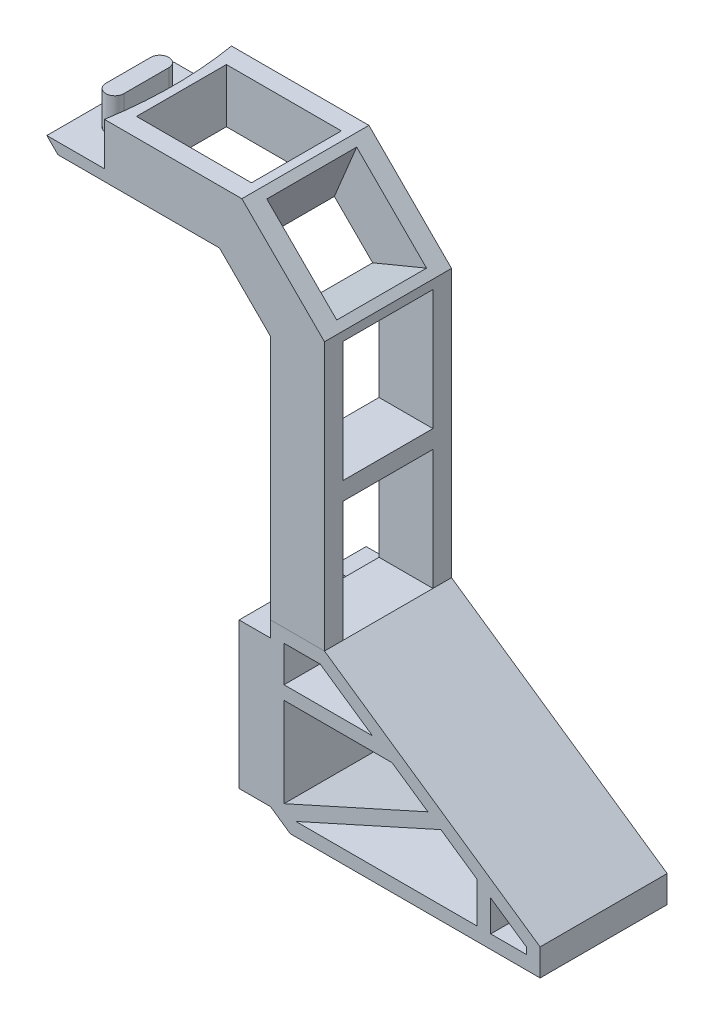
from build123d import *

# Parameters (mm, degrees)
BOSS_EXTRUDE1_DEPTH = 14.14
CUT_EXTRUDE1_REACH  = 40.3
BOSS_EXTRUDE2_DEPTH = 14.14
BOSS_EXTRUDE8_REACH = 69.576
BOSS_EXTRUDE5_DEPTH = 3.75
SKETCH10_W          = 14.14
SKETCH10_H          = 1.75
BOSS_EXTRUDE6_DEPTH = 3.5
BOSS_EXTRUDE7_DEPTH = 14.5
SKETCH15_W          = 6
SKETCH15_H          = 13.403805922
CUT_EXTRUDE7_DEPTH  = 5


with BuildPart() as part:
    # Sketch1 → Boss-Extrude1 (new body)
    with BuildSketch(Plane.XY):
        Polygon((0.707106781, 0), (0.707106781, 18), (6.707106781, 18), (30.707106781, 1.488209222), (30.707106781, -1.511790778), (2.904504941, -1.511790778), align=None)
    extrude(amount=BOSS_EXTRUDE1_DEPTH)

    # Sketch2 → Cut-Extrude1 (cut, up to next)
    with BuildSketch(Plane.XY.offset(14.14), mode=Mode.PRIVATE) as cut_extrude1_sk1:
        Polygon((2.207106781, 16.5), (2.207106781, 12.5), (12.054974944, 12.5), (6.240947786, 16.5), align=None)
    cut_extrude1_tool1 = extrude(cut_extrude1_sk1.sketch, amount=-CUT_EXTRUDE1_REACH, mode=Mode.PRIVATE) & part.part
    # Sketch2 → Cut-Extrude1 (cut, up to next)
    with BuildSketch(Plane.XY.offset(14.14), mode=Mode.PRIVATE) as cut_extrude1_sk2:
        Polygon((14.235235128, 11), (2.207106781, 11), (2.207106781, 1.039488327), (18.219044647, 8.25917378), align=None)
    cut_extrude1_tool2 = extrude(cut_extrude1_sk2.sketch, amount=-CUT_EXTRUDE1_REACH, mode=Mode.PRIVATE) & part.part
    # Sketch2 → Cut-Extrude1 (cut, up to next)
    with BuildSketch(Plane.XY.offset(14.14), mode=Mode.PRIVATE) as cut_extrude1_sk3:
        Polygon((23.707106781, 4.483434874), (19.663816354, 7.265183441), (3.524822517, -0.011790778), (23.707106781, -0.011790778), align=None)
    cut_extrude1_tool3 = extrude(cut_extrude1_sk3.sketch, amount=-CUT_EXTRUDE1_REACH, mode=Mode.PRIVATE) & part.part
    # Sketch2 → Cut-Extrude1 (cut, up to next)
    with BuildSketch(Plane.XY.offset(14.14), mode=Mode.PRIVATE) as cut_extrude1_sk4:
        Polygon((29.207106781, 0.699482821), (25.207106781, 3.451447951), (25.207106781, -0.011790778), (29.207106781, -0.011790778), align=None)
    cut_extrude1_tool4 = extrude(cut_extrude1_sk4.sketch, amount=-CUT_EXTRUDE1_REACH, mode=Mode.PRIVATE) & part.part
    add(cut_extrude1_tool1.solids().sort_by_distance((5.880456, 14.220782, 14.14))[0], mode=Mode.SUBTRACT)
    add(cut_extrude1_tool2.solids().sort_by_distance((8.231218, 7.334959, 14.14))[0], mode=Mode.SUBTRACT)
    add(cut_extrude1_tool3.solids().sort_by_distance((16.372786, 2.578882, 14.14))[0], mode=Mode.SUBTRACT)
    add(cut_extrude1_tool4.solids().sort_by_distance((26.76762, 1.183019, 14.14))[0], mode=Mode.SUBTRACT)

    # Sketch10 → Boss-Extrude6 (add)
    with BuildSketch(Plane.ZY.offset(-0.707106781)):
        with Locations((7.07, 0.875)):
            Rectangle(SKETCH10_W, SKETCH10_H)
    extrude(amount=BOSS_EXTRUDE6_DEPTH)

    # Sketch11 → Boss-Extrude7 (add)
    with BuildSketch(Plane(origin=(0, 1.75, 0), x_dir=(1, 0, 0), z_dir=(0, 1, 0))):
        Polygon((0.707106781, -14.14), (-2.792893219, -14.14), (-2.792893219, -10.14), (-1.042893219, -10.14), (-1.042893219, -11.89), (0.707106781, -11.89), align=None)
        Polygon((-2.792893219, 0), (0.707106781, 0), (0.707106781, -1.75), (-1.042893219, -1.75), (-1.042893219, -4), (-2.792893219, -4), align=None)
    extrude(amount=BOSS_EXTRUDE7_DEPTH)


with BuildPart() as body_2:
    # Sketch3 → Boss-Extrude2 (new body)
    with BuildSketch(Plane.XY.offset(14.14)):
        Polygon((6.707106781, 47.807611845), (-2.485281374, 57), (-17.192746874, 57), (-17.192746874, 52.238056789), (-24.192746874, 52.238056789), (-22.954690085, 51), (-4.970562748, 51), (0.707106781, 45.32233047), (0.707106781, 18), (6.707106781, 18), align=None)
    extrude(amount=-BOSS_EXTRUDE2_DEPTH)

    # Sketch4 → Boss-Extrude8 (add, up to next)
    with BuildSketch(Plane(origin=(0, 57, 0), x_dir=(1, 0, 0), z_dir=(0, 1, 0)), mode=Mode.PRIVATE) as boss_extrude8_sk1:
        with BuildLine():
            Line((-17.192746874, -14.14), (-17.192746874, -7.069999811))
            ThreePointArc((-17.192746874, -7.069999811), (-17.339728951, -10.617159889), (-17.779667479, -14.14))
            Line((-17.779667479, -14.14), (-17.192746874, -14.14))
        make_face()
    boss_extrude8_tool1 = extrude(boss_extrude8_sk1.sketch, amount=-BOSS_EXTRUDE8_REACH, mode=Mode.PRIVATE) - body_2.part
    # Sketch4 → Boss-Extrude8 (add, up to next)
    with BuildSketch(Plane(origin=(0, 57, 0), x_dir=(1, 0, 0), z_dir=(0, 1, 0)), mode=Mode.PRIVATE) as boss_extrude8_sk2:
        with BuildLine():
            Line((-17.192746874, 0), (-17.779667479, 0))
            ThreePointArc((-17.779667479, 0), (-17.339728967, -3.522839922), (-17.192746874, -7.069999811))
            Line((-17.192746874, -7.069999811), (-17.192746874, 0))
        make_face()
    boss_extrude8_tool2 = extrude(boss_extrude8_sk2.sketch, amount=-BOSS_EXTRUDE8_REACH, mode=Mode.PRIVATE) - body_2.part
    add(boss_extrude8_tool1.solids().sort_by_distance((-17.368615, 57, 12.374929))[0])
    add(boss_extrude8_tool2.solids().sort_by_distance((-17.368615, 57, 1.765071))[0])

    # Sketch9 → Boss-Extrude5 (add)
    with BuildSketch(Plane(origin=(0, 52.238056789, 0), x_dir=(1, 0, 0), z_dir=(0, 1, 0))):
        with BuildLine():
            Line((-20.192746874, -4.57), (-20.192746874, -9.57))
            ThreePointArc((-20.192746874, -9.57), (-21.192746874, -10.57), (-22.192746874, -9.57))
            Line((-22.192746874, -9.57), (-22.192746874, -4.57))
            ThreePointArc((-22.192746874, -4.57), (-21.192746874, -3.57), (-20.192746874, -4.57))
        make_face()
    extrude(amount=BOSS_EXTRUDE5_DEPTH)

    # Sketch15 → Cut-Extrude7 (cut, symmetric)
    with BuildSketch(Plane(origin=(0, 0, 7.07), x_dir=(-1, 0, 0), z_dir=(0, 0, -1))):
        Polygon((16.279667479, 51), (16.279667479, 57), (3.485281374, 57), (5.970562748, 51), align=None)
        Polygon((-6.707106781, 46.807611845), (-0.707106781, 44.32233047), (-0.707106781, 33.403805922), (-6.707106781, 33.403805922), align=None)
        Polygon((-6, 48.514718626), (0, 46.029437252), (4.263455967, 50.292893219), (1.778174593, 56.292893219), align=None)
        with Locations((-3.707106781, 24.701902961)):
            Rectangle(SKETCH15_W, SKETCH15_H)
    extrude(amount=CUT_EXTRUDE7_DEPTH, both=True, mode=Mode.SUBTRACT)


solid = Compound([part.part, body_2.part])
